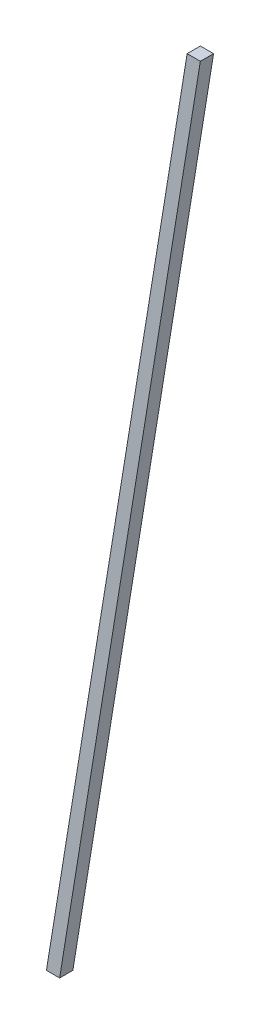
from build123d import *

# Parameters (mm, degrees)
EXTRUDE_1_DEPTH = 5


with BuildPart() as part:
    # Model → 凸台-拉伸1 (new body)
    with BuildSketch(Plane.XY):
        Polygon((72.09768244, 329.578743165), (18.856719225, 2.578743165), (23.856719225, 2.578743165), (77.09768244, 329.578743165), align=None)
    extrude(amount=EXTRUDE_1_DEPTH)


solid = part.part
